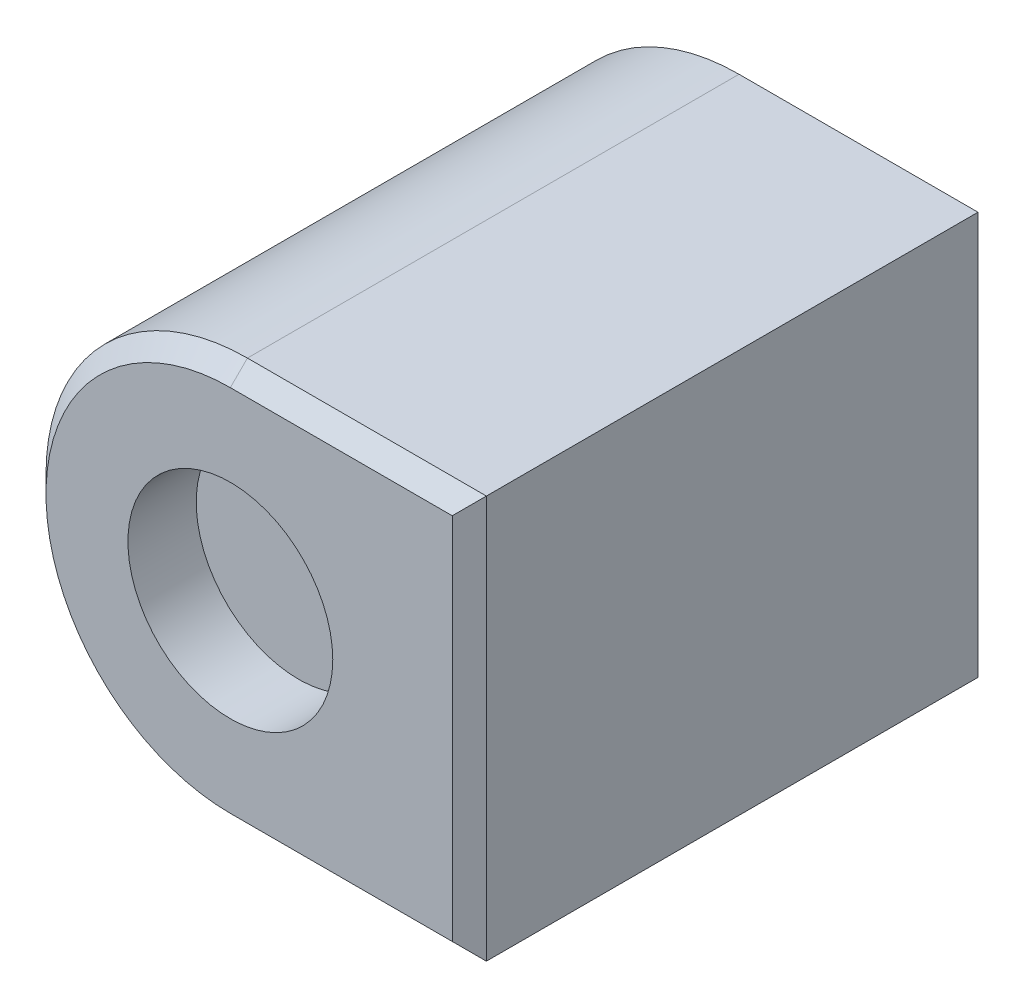
from build123d import *

# Parameters (mm, degrees)
SALIENTE_EXTRUIR1_DEPTH = 149
CHAFL_N1_SIZE           = 5
CROQUIS2_R              = 30
CORTAR_EXTRUIR1_DEPTH   = 20


with BuildPart() as part:
    # Croquis1 → Saliente-Extruir1 (new body)
    with BuildSketch(Plane.XY):
        with BuildLine():
            Line((0, 59), (70, 59))
            Line((70, 59), (70, -59))
            Line((70, -59), (0, -59))
            ThreePointArc((0, -59), (-59, 0), (0, 59))
        make_face()
    extrude(amount=SALIENTE_EXTRUIR1_DEPTH)

    # Chaflán1
    chafl_n1_edges = [part.edges().sort_by_distance(p)[0] for p in [
        (70, 0, 149),
        (35, 59, 149),
        (-59, 0, 149),
        (35, -59, 149),
    ]]
    chamfer(chafl_n1_edges, length=CHAFL_N1_SIZE)

    # Croquis2 → Cortar-Extruir1 (cut)
    with BuildSketch(Plane.XY.offset(149)):
        Circle(CROQUIS2_R)
    extrude(amount=-CORTAR_EXTRUIR1_DEPTH, mode=Mode.SUBTRACT)


solid = part.part
